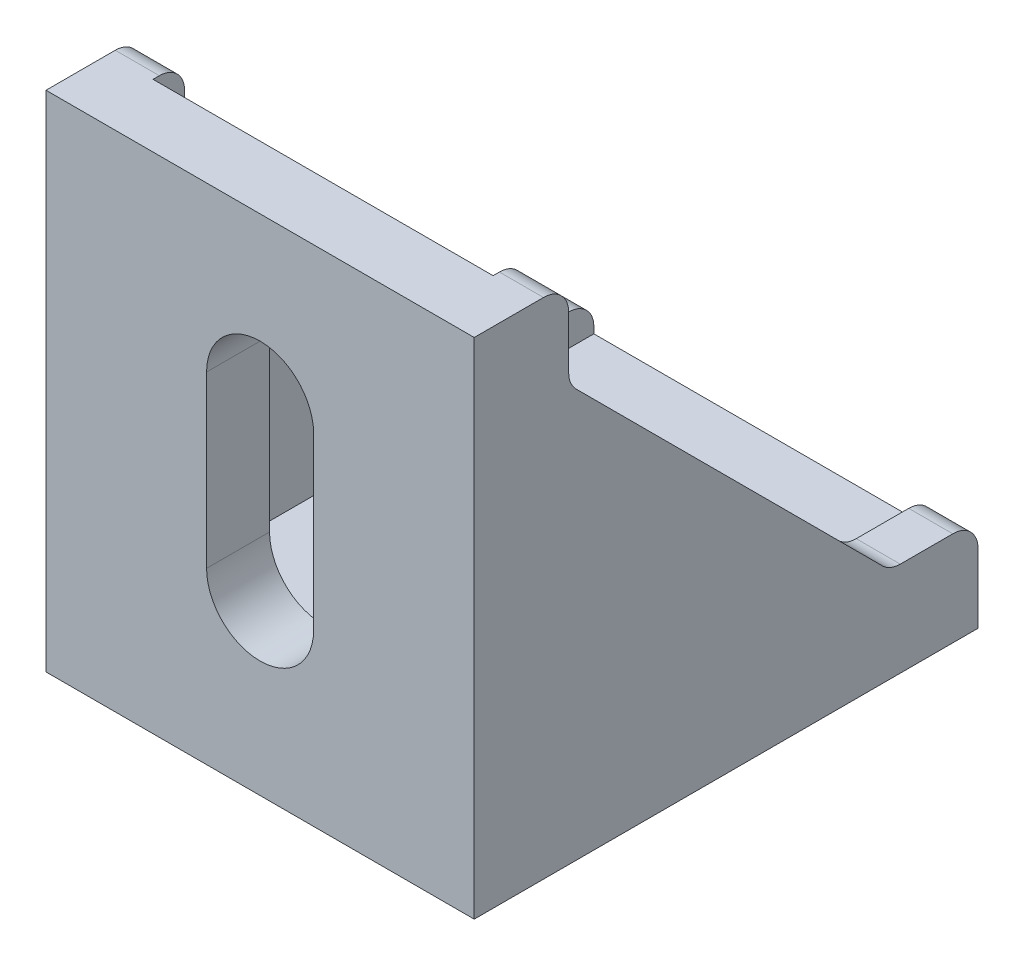
from build123d import *

# Parameters (mm, degrees)
EXTRUDE_1_DEPTH     = 34
EXTRUDE_2_DEPTH     = 3.5
CUT_EXTRUDE_1_REACH = 62.05
CUT_EXTRUDE_2_REACH = 65.095
FILLET_1_R          = 2


with BuildPart() as part:
    # 草图1 → 凸台-拉伸1 (new body)
    with BuildSketch(Plane(origin=(0, 0, 0), x_dir=(0, 0, -1), z_dir=(1, 0, 0))):
        Polygon((0, 0), (0, 35), (5, 35), (5, 0), (40, 0), (40, -5), (0, -5), align=None)
    extrude(amount=EXTRUDE_1_DEPTH)

    # 草图2 → 凸台-拉伸2 (add)
    with BuildSketch(Plane(origin=(34, 0, 0), x_dir=(0, 0, -1), z_dir=(1, 0, 0))):
        Polygon((40, 0), (40, 2.5), (33, 2.5), (7.5, 28), (7.5, 35), (5, 35), (5, 0), align=None)
    extrude_2 = extrude(amount=-EXTRUDE_2_DEPTH)

    # 镜向1: 凸台-拉伸2 across plane
    add(extrude_2.mirror(Plane(origin=(17, 0, 0), x_dir=(0, 0, 1), z_dir=(1, 0, 0))))

    # 草图4 → 切除-拉伸1 (cut, up to next)
    with BuildSketch(Plane(origin=(0, 0, -5), x_dir=(-1, 0, 0), z_dir=(0, 0, -1)), mode=Mode.PRIVATE) as cut_extrude_1_sk1:
        with BuildLine():
            Line((-12.75, 22), (-12.75, 8.5))
            ThreePointArc((-12.75, 8.5), (-17, 4.25), (-21.25, 8.5))
            Line((-21.25, 8.5), (-21.25, 22))
            ThreePointArc((-21.25, 22), (-17, 26.25), (-12.75, 22))
        make_face()
    cut_extrude_1_tool1 = extrude(cut_extrude_1_sk1.sketch, amount=-CUT_EXTRUDE_1_REACH, mode=Mode.PRIVATE) & part.part
    add(cut_extrude_1_tool1.solids().sort_by_distance((17, 15.25, -5))[0], mode=Mode.SUBTRACT)

    # 草图5 → 切除-拉伸2 (cut, up to next)
    with BuildSketch(Plane(origin=(0, 0, 0), x_dir=(1, 0, 0), z_dir=(0, 1, 0)), mode=Mode.PRIVATE) as cut_extrude_2_sk1:
        with BuildLine():
            Line((21.25, 27), (21.25, 13.5))
            ThreePointArc((21.25, 13.5), (17, 9.25), (12.75, 13.5))
            Line((12.75, 13.5), (12.75, 27))
            ThreePointArc((12.75, 27), (17, 31.25), (21.25, 27))
        make_face()
    cut_extrude_2_tool1 = extrude(cut_extrude_2_sk1.sketch, amount=-CUT_EXTRUDE_2_REACH, mode=Mode.PRIVATE) & part.part
    add(cut_extrude_2_tool1.solids().sort_by_distance((17, 0, -20.25))[0], mode=Mode.SUBTRACT)

    # 圆角1
    fillet_1_edges = [part.edges().sort_by_distance(p)[0] for p in [
        (32.25, 35, -7.5),
        (32.25, 28, -7.5),
        (32.25, 2.5, -33),
        (32.25, 2.5, -40),
        (1.75, 2.5, -40),
        (1.75, 2.5, -33),
        (1.75, 28, -7.5),
        (1.75, 35, -7.5),
    ]]
    fillet(fillet_1_edges, radius=FILLET_1_R)


solid = part.part
